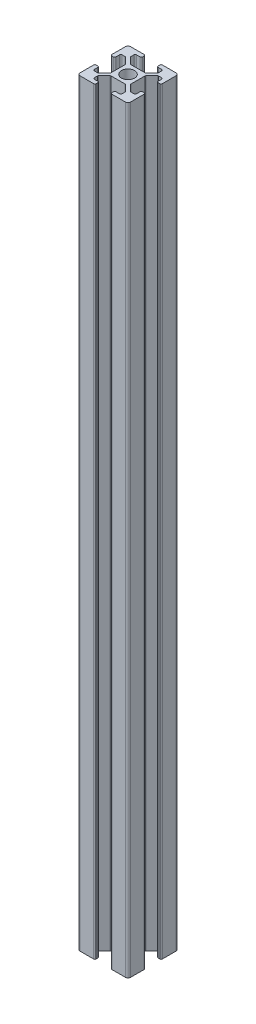
from build123d import *

# Parameters (mm, degrees)
SKETCH_1_R      = 2.6
EXTRUDE_2_DEPTH = 300


with BuildPart() as part:
    # 草图1 → 凸台-拉伸2 (new body)
    with BuildSketch(Plane(origin=(0, 170, 0), x_dir=(1, 0, 0), z_dir=(0, 1, 0))):
        with BuildLine():
            Line((-3.1, 8.85), (-3.1, 9.5))
            ThreePointArc((-3.1, 9.5), (-3.246446609, 9.853553391), (-3.6, 10))
            Line((-3.6, 10), (-9, 10))
            ThreePointArc((-9, 10), (-9.707106781, 9.707106781), (-10, 9))
            Line((-10, 9), (-10, 3.6))
            ThreePointArc((-10, 3.6), (-9.853553391, 3.246446609), (-9.5, 3.1))
            Line((-9.5, 3.1), (-8.85, 3.1))
            ThreePointArc((-8.85, 3.1), (-8.496446609, 3.246446609), (-8.35, 3.6))
            Line((-8.35, 3.6), (-8.35, 5))
            ThreePointArc((-8.35, 5), (-8.203553391, 5.353553391), (-7.85, 5.5))
            Line((-7.85, 5.5), (-6.626345597, 5.5))
            ThreePointArc((-6.626345597, 5.5), (-6.435003881, 5.461939766), (-6.272792206, 5.353553391))
            Line((-6.272792206, 5.353553391), (-4.046446609, 3.127207794))
            ThreePointArc((-4.046446609, 3.127207794), (-3.938060234, 2.964996119), (-3.9, 2.773654403))
            Line((-3.9, 2.773654403), (-3.9, -2.773654403))
            ThreePointArc((-3.9, -2.773654403), (-3.938060234, -2.964996119), (-4.046446609, -3.127207794))
            Line((-4.046446609, -3.127207794), (-6.272792206, -5.353553391))
            ThreePointArc((-6.272792206, -5.353553391), (-6.435003881, -5.461939766), (-6.626345597, -5.5))
            Line((-6.626345597, -5.5), (-7.85, -5.5))
            ThreePointArc((-7.85, -5.5), (-8.203553391, -5.353553391), (-8.35, -5))
            Line((-8.35, -5), (-8.35, -3.6))
            ThreePointArc((-8.35, -3.6), (-8.496446609, -3.246446609), (-8.85, -3.1))
            Line((-8.85, -3.1), (-9.5, -3.1))
            ThreePointArc((-9.5, -3.1), (-9.853553391, -3.246446609), (-10, -3.6))
            Line((-10, -3.6), (-10, -9))
            ThreePointArc((-10, -9), (-9.707106781, -9.707106781), (-9, -10))
            Line((-9, -10), (-3.6, -10))
            ThreePointArc((-3.6, -10), (-3.246446609, -9.853553391), (-3.1, -9.5))
            Line((-3.1, -9.5), (-3.1, -8.85))
            ThreePointArc((-3.1, -8.85), (-3.246446609, -8.496446609), (-3.6, -8.35))
            Line((-3.6, -8.35), (-5, -8.35))
            ThreePointArc((-5, -8.35), (-5.353553391, -8.203553391), (-5.5, -7.85))
            Line((-5.5, -7.85), (-5.5, -6.626345597))
            ThreePointArc((-5.5, -6.626345597), (-5.461939766, -6.435003881), (-5.353553391, -6.272792206))
            Line((-5.353553391, -6.272792206), (-3.127207794, -4.046446609))
            ThreePointArc((-3.127207794, -4.046446609), (-2.964996119, -3.938060234), (-2.773654403, -3.9))
            Line((-2.773654403, -3.9), (2.773654403, -3.9))
            ThreePointArc((2.773654403, -3.9), (2.964996119, -3.938060234), (3.127207794, -4.046446609))
            Line((3.127207794, -4.046446609), (5.353553391, -6.272792206))
            ThreePointArc((5.353553391, -6.272792206), (5.461939766, -6.435003881), (5.5, -6.626345597))
            Line((5.5, -6.626345597), (5.5, -7.85))
            ThreePointArc((5.5, -7.85), (5.353553391, -8.203553391), (5, -8.35))
            Line((5, -8.35), (3.6, -8.35))
            ThreePointArc((3.6, -8.35), (3.246446609, -8.496446609), (3.1, -8.85))
            Line((3.1, -8.85), (3.1, -9.5))
            ThreePointArc((3.1, -9.5), (3.246446609, -9.853553391), (3.6, -10))
            Line((3.6, -10), (9, -10))
            ThreePointArc((9, -10), (9.707106781, -9.707106781), (10, -9))
            Line((10, -9), (10, -3.6))
            ThreePointArc((10, -3.6), (9.853553391, -3.246446609), (9.5, -3.1))
            Line((9.5, -3.1), (8.85, -3.1))
            ThreePointArc((8.85, -3.1), (8.496446609, -3.246446609), (8.35, -3.6))
            Line((8.35, -3.6), (8.35, -5))
            ThreePointArc((8.35, -5), (8.203553391, -5.353553391), (7.85, -5.5))
            Line((7.85, -5.5), (6.626345597, -5.5))
            ThreePointArc((6.626345597, -5.5), (6.435003881, -5.461939766), (6.272792206, -5.353553391))
            Line((6.272792206, -5.353553391), (4.046446609, -3.127207794))
            ThreePointArc((4.046446609, -3.127207794), (3.938060234, -2.964996119), (3.9, -2.773654403))
            Line((3.9, -2.773654403), (3.9, 2.773654403))
            ThreePointArc((3.9, 2.773654403), (3.938060234, 2.964996119), (4.046446609, 3.127207794))
            Line((4.046446609, 3.127207794), (6.272792206, 5.353553391))
            ThreePointArc((6.272792206, 5.353553391), (6.435003881, 5.461939766), (6.626345597, 5.5))
            Line((6.626345597, 5.5), (7.85, 5.5))
            ThreePointArc((7.85, 5.5), (8.203553391, 5.353553391), (8.35, 5))
            Line((8.35, 5), (8.35, 3.6))
            ThreePointArc((8.35, 3.6), (8.496446609, 3.246446609), (8.85, 3.1))
            Line((8.85, 3.1), (9.5, 3.1))
            ThreePointArc((9.5, 3.1), (9.853553391, 3.246446609), (10, 3.6))
            Line((10, 3.6), (10, 9))
            ThreePointArc((10, 9), (9.707106781, 9.707106781), (9, 10))
            Line((9, 10), (3.6, 10))
            ThreePointArc((3.6, 10), (3.246446609, 9.853553391), (3.1, 9.5))
            Line((3.1, 9.5), (3.1, 8.85))
            ThreePointArc((3.1, 8.85), (3.246446609, 8.496446609), (3.6, 8.35))
            Line((3.6, 8.35), (5, 8.35))
            ThreePointArc((5, 8.35), (5.353553391, 8.203553391), (5.5, 7.85))
            Line((5.5, 7.85), (5.5, 6.626345597))
            ThreePointArc((5.5, 6.626345597), (5.461939766, 6.435003881), (5.353553391, 6.272792206))
            Line((5.353553391, 6.272792206), (3.127207794, 4.046446609))
            ThreePointArc((3.127207794, 4.046446609), (2.964996119, 3.938060234), (2.773654403, 3.9))
            Line((2.773654403, 3.9), (-2.773654403, 3.9))
            ThreePointArc((-2.773654403, 3.9), (-2.964996119, 3.938060234), (-3.127207794, 4.046446609))
            Line((-3.127207794, 4.046446609), (-5.5, 6.419238816))
            Line((-5.5, 6.419238816), (-5.5, 7.85))
            ThreePointArc((-5.5, 7.85), (-5.353553391, 8.203553391), (-5, 8.35))
            Line((-5, 8.35), (-3.6, 8.35))
            ThreePointArc((-3.6, 8.35), (-3.246446609, 8.496446609), (-3.1, 8.85))
        make_face()
        with Locations(Location((0, 0, 0), (0, 0, 90))):
            Circle(SKETCH_1_R, mode=Mode.SUBTRACT)
    extrude(amount=EXTRUDE_2_DEPTH)


solid = part.part
